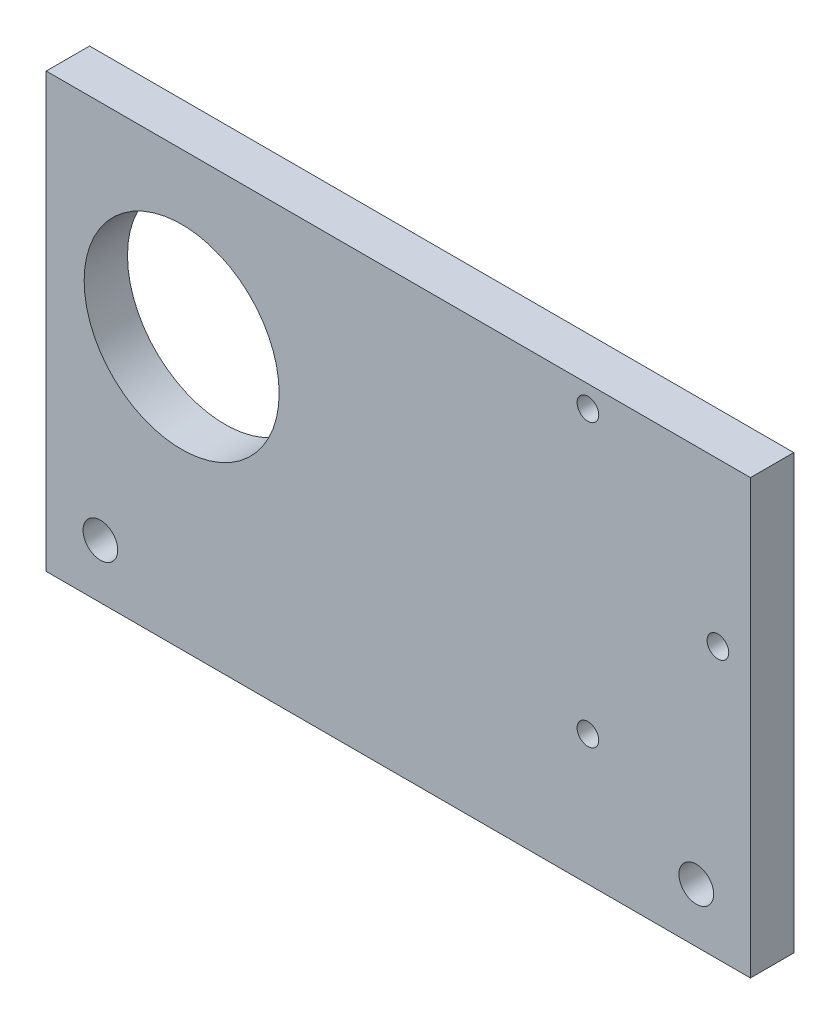
from build123d import *

# Parameters (mm, degrees)
SKETCH_1_W      = 65
SKETCH_1_H      = 40
SKETCH_1_R      = 1.6
SKETCH_1_R_2    = 1
SKETCH_1_R_3    = 9
EXTRUDE_1_DEPTH = 4


with BuildPart() as part:
    # ｽｹｯﾁ1 → ﾎﾞｽ - 押し出し1 (new body)
    with BuildSketch(Plane.XY):
        with Locations((32.5, 20)):
            Rectangle(SKETCH_1_W, SKETCH_1_H)
        with Locations((5, 5)):
            Circle(SKETCH_1_R, mode=Mode.SUBTRACT)
        with Locations((60, 5)):
            Circle(SKETCH_1_R, mode=Mode.SUBTRACT)
        with Locations((50, 12)):
            Circle(SKETCH_1_R_2, mode=Mode.SUBTRACT)
        with Locations((62, 25)):
            Circle(SKETCH_1_R_2, mode=Mode.SUBTRACT)
        with Locations((50, 38)):
            Circle(SKETCH_1_R_2, mode=Mode.SUBTRACT)
        with Locations((12.5, 25)):
            Circle(SKETCH_1_R_3, mode=Mode.SUBTRACT)
    extrude(amount=EXTRUDE_1_DEPTH)


solid = part.part
